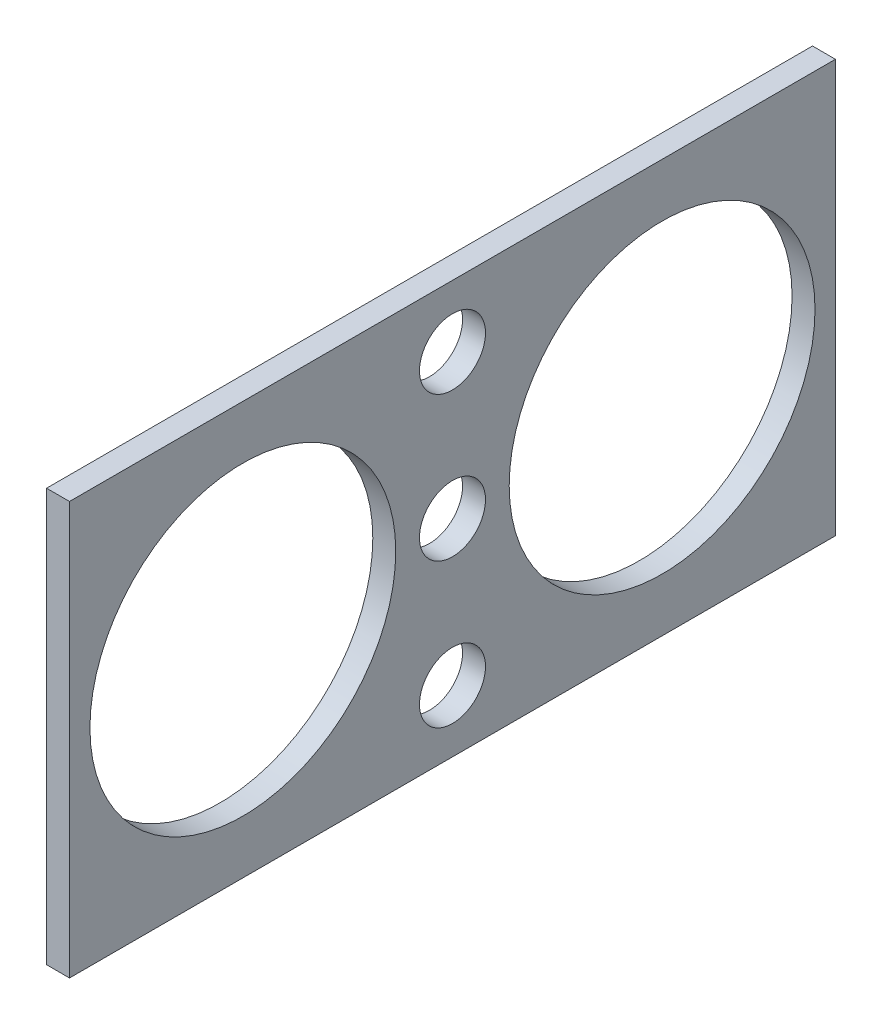
from build123d import *

# Parameters (mm, degrees)
SKETCH2_W           = 47.13986
SKETCH2_H           = 25.4
SKETCH2_R           = 2.032
SKETCH2_R_2         = 9.411008891
BOSS_EXTRUDE1_DEPTH = 1.41224


with BuildPart() as part:
    # Sketch2 → Boss-Extrude1 (new body)
    with BuildSketch(Plane(origin=(0, 0, 0), x_dir=(0, 0, -1), z_dir=(1, 0, 0))):
        with Locations((23.56993, 12.7)):
            Rectangle(SKETCH2_W, SKETCH2_H)
        with Locations((23.56993, 21.59)):
            Circle(SKETCH2_R, mode=Mode.SUBTRACT)
        with Locations((23.56993, 12.7)):
            Circle(SKETCH2_R, mode=Mode.SUBTRACT)
        with Locations((23.56993, 3.81)):
            Circle(SKETCH2_R, mode=Mode.SUBTRACT)
        with Locations((10.668, 12.7)):
            Circle(SKETCH2_R_2, mode=Mode.SUBTRACT)
        with Locations(Location((36.47186, 12.7, 0), (0, 0, 180))):
            Circle(SKETCH2_R_2, mode=Mode.SUBTRACT)
    extrude(amount=-BOSS_EXTRUDE1_DEPTH)


solid = part.part
